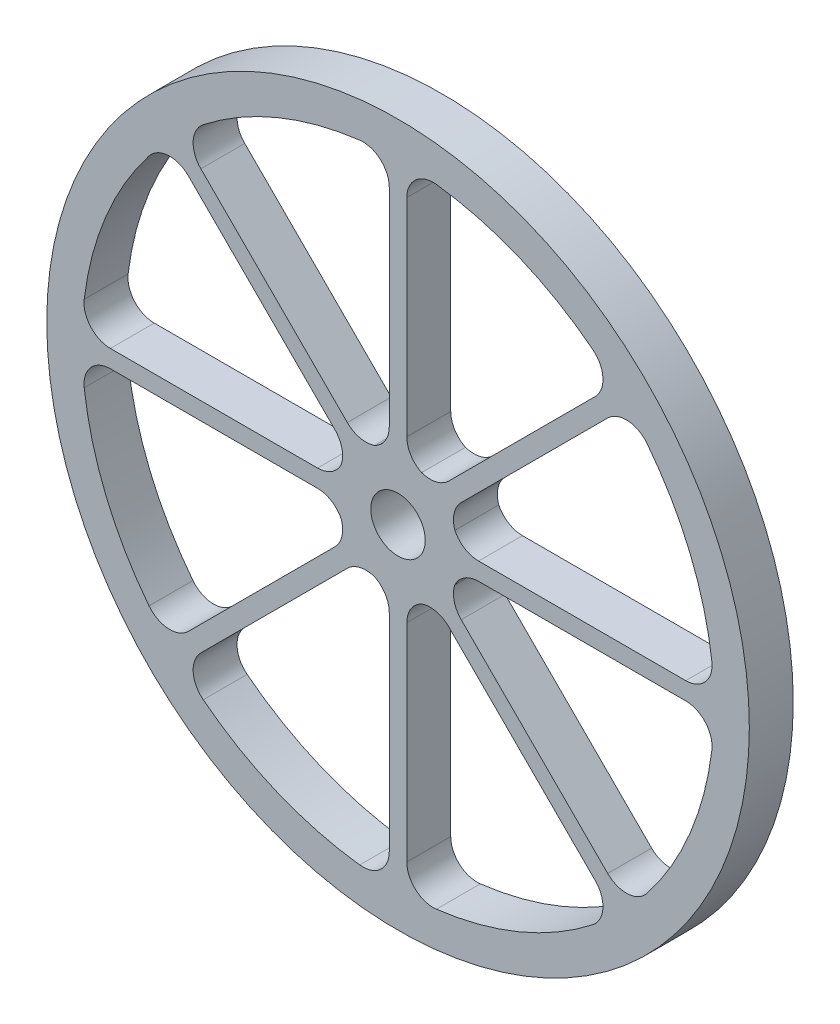
from build123d import *

# Parameters (mm, degrees)
MODEL_R         = 40
MODEL_R_2       = 3.1
EXTRUDE_1_DEPTH = 5


with BuildPart() as part:
    # Model → 凸台-拉伸1 (new body)
    with BuildSketch(Plane.XY):
        with Locations((58.671935635, 46.97216953)):
            Circle(MODEL_R)
        with Locations((58.671935635, 46.97216953)):
            Circle(MODEL_R_2, mode=Mode.SUBTRACT)
        with BuildLine():
            Line((57.671935635, 56.13732092), (57.671935635, 79.728848239))
            ThreePointArc((57.671935635, 79.728848239), (56.66053953, 81.975057166), (54.308299271, 82.706728121))
            ThreePointArc((54.308299271, 82.706728121), (44.895332069, 80.231832701), (36.489343796, 75.325875096))
            ThreePointArc((36.489343796, 75.325875096), (35.343428251, 73.145220564), (36.216572772, 70.841745955))
            Line((36.216572772, 70.841745955), (52.898301717, 54.16001701))
            ThreePointArc((52.898301717, 54.16001701), (54.342318321, 53.358794002), (55.991568665, 53.443147825))
            ThreePointArc((55.991568665, 53.443147825), (57.217411925, 54.549696766), (57.671935635, 56.13732092))
        make_face(mode=Mode.SUBTRACT)
        with BuildLine():
            Line((64.445569552, 54.16001701), (81.127298497, 70.841745955))
            ThreePointArc((81.127298497, 70.841745955), (82.000443018, 73.145220564), (80.854527474, 75.325875096))
            ThreePointArc((80.854527474, 75.325875096), (72.4485392, 80.231832701), (63.035571998, 82.706728121))
            ThreePointArc((63.035571998, 82.706728121), (60.683331739, 81.975057166), (59.671935635, 79.728848239))
            Line((59.671935635, 79.728848239), (59.671935635, 56.13732092))
            ThreePointArc((59.671935635, 56.13732092), (60.126459344, 54.549696766), (61.352302605, 53.443147825))
            ThreePointArc((61.352302605, 53.443147825), (63.001552948, 53.358794002), (64.445569552, 54.16001701))
        make_face(mode=Mode.SUBTRACT)
        with BuildLine():
            Line((67.837087024, 47.97216953), (91.428614343, 47.97216953))
            ThreePointArc((91.428614343, 47.97216953), (93.67482327, 48.983565635), (94.406494225, 51.335805894))
            ThreePointArc((94.406494225, 51.335805894), (91.931598805, 60.748773096), (87.0256412, 69.154761369))
            ThreePointArc((87.0256412, 69.154761369), (84.844986668, 70.300676914), (82.54151206, 69.427532393))
            Line((82.54151206, 69.427532393), (65.859783114, 52.745803448))
            ThreePointArc((65.859783114, 52.745803448), (65.058560106, 51.301786844), (65.142913929, 49.652536502))
            ThreePointArc((65.142913929, 49.652536502), (66.24946287, 48.42669324), (67.837087024, 47.97216953))
        make_face(mode=Mode.SUBTRACT)
        with BuildLine():
            Line((65.859783114, 41.198535613), (82.54151206, 24.516806668))
            ThreePointArc((82.54151206, 24.516806668), (84.844986668, 23.643662147), (87.0256412, 24.789577691))
            ThreePointArc((87.0256412, 24.789577691), (91.931598805, 33.195565965), (94.406494225, 42.608533167))
            ThreePointArc((94.406494225, 42.608533167), (93.67482327, 44.960773426), (91.428614343, 45.97216953))
            Line((91.428614343, 45.97216953), (67.837087024, 45.97216953))
            ThreePointArc((67.837087024, 45.97216953), (66.24946287, 45.51764582), (65.142913929, 44.291802559))
            ThreePointArc((65.142913929, 44.291802559), (65.058560106, 42.642552216), (65.859783114, 41.198535613))
        make_face(mode=Mode.SUBTRACT)
        with BuildLine():
            Line((59.671935635, 37.807018141), (59.671935635, 14.215490822))
            ThreePointArc((59.671935635, 14.215490822), (60.683331739, 11.969281895), (63.035571998, 11.23761094))
            ThreePointArc((63.035571998, 11.23761094), (72.4485392, 13.71250636), (80.854527474, 18.618463965))
            ThreePointArc((80.854527474, 18.618463965), (82.000443018, 20.799118497), (81.127298497, 23.102593105))
            Line((81.127298497, 23.102593105), (64.445569552, 39.784322051))
            ThreePointArc((64.445569552, 39.784322051), (63.001552948, 40.585545059), (61.352302606, 40.501191236))
            ThreePointArc((61.352302606, 40.501191236), (60.126459344, 39.394642295), (59.671935635, 37.807018141))
        make_face(mode=Mode.SUBTRACT)
        with BuildLine():
            Line((52.898301717, 39.784322051), (36.216572772, 23.102593105))
            ThreePointArc((36.216572772, 23.102593105), (35.343428251, 20.799118497), (36.489343796, 18.618463965))
            ThreePointArc((36.489343796, 18.618463965), (44.895332069, 13.71250636), (54.308299271, 11.23761094))
            ThreePointArc((54.308299271, 11.23761094), (56.66053953, 11.969281895), (57.671935635, 14.215490822))
            Line((57.671935635, 14.215490822), (57.671935635, 37.807018141))
            ThreePointArc((57.671935635, 37.807018141), (57.217411925, 39.394642295), (55.991568664, 40.501191236))
            ThreePointArc((55.991568664, 40.501191236), (54.342318321, 40.585545059), (52.898301717, 39.784322051))
        make_face(mode=Mode.SUBTRACT)
        with BuildLine():
            Line((49.506784245, 45.97216953), (25.915256926, 45.97216953))
            ThreePointArc((25.915256926, 45.97216953), (23.669047999, 44.960773426), (22.937377044, 42.608533167))
            ThreePointArc((22.937377044, 42.608533167), (25.412272464, 33.195565965), (30.318230069, 24.789577691))
            ThreePointArc((30.318230069, 24.789577691), (32.498884601, 23.643662147), (34.80235921, 24.516806668))
            Line((34.80235921, 24.516806668), (51.484088155, 41.198535613))
            ThreePointArc((51.484088155, 41.198535613), (52.285311163, 42.642552216), (52.20095734, 44.291802559))
            ThreePointArc((52.20095734, 44.291802559), (51.0944084, 45.51764582), (49.506784245, 45.97216953))
        make_face(mode=Mode.SUBTRACT)
        with BuildLine():
            Line((51.484088155, 52.745803448), (34.80235921, 69.427532393))
            ThreePointArc((34.80235921, 69.427532393), (32.498884601, 70.300676914), (30.318230069, 69.154761369))
            ThreePointArc((30.318230069, 69.154761369), (25.412272464, 60.748773096), (22.937377044, 51.335805894))
            ThreePointArc((22.937377044, 51.335805894), (23.669047999, 48.983565635), (25.915256926, 47.97216953))
            Line((25.915256926, 47.97216953), (49.506784245, 47.97216953))
            ThreePointArc((49.506784245, 47.97216953), (51.094408399, 48.42669324), (52.20095734, 49.652536501))
            ThreePointArc((52.20095734, 49.652536501), (52.285311163, 51.301786844), (51.484088155, 52.745803448))
        make_face(mode=Mode.SUBTRACT)
    extrude(amount=EXTRUDE_1_DEPTH)


solid = part.part
